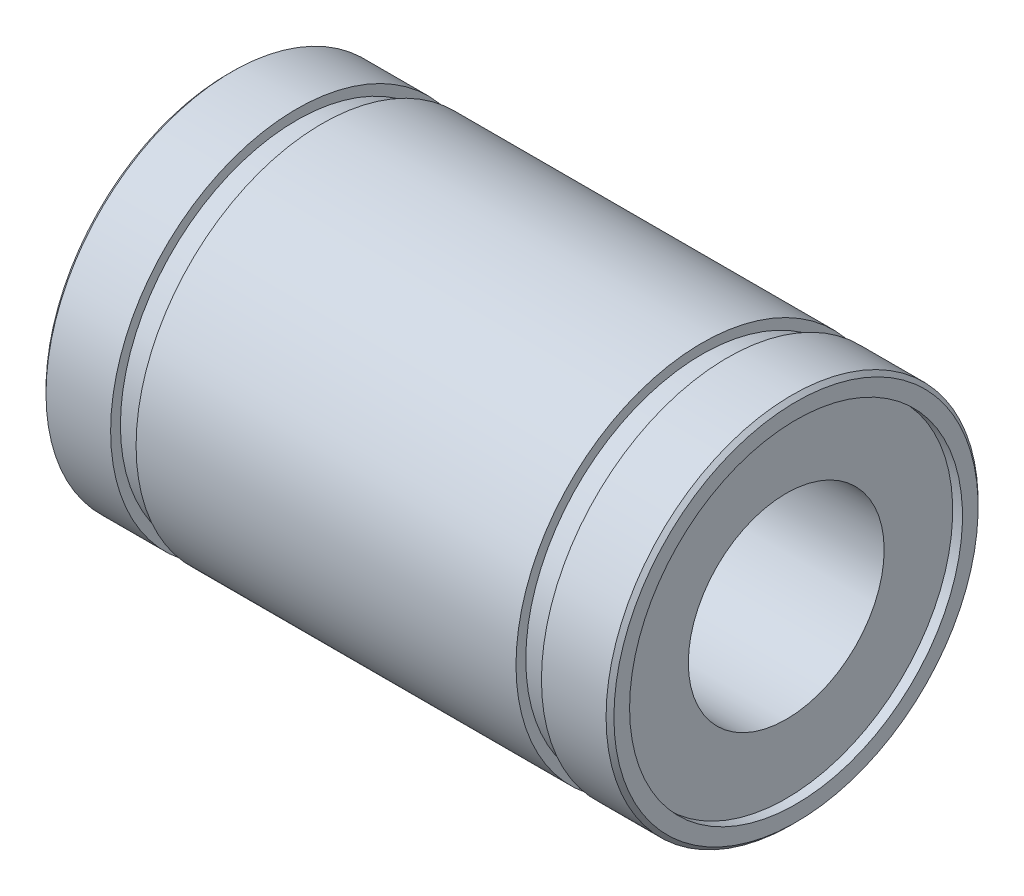
from build123d import *

# Parameters (mm, degrees)
CHAMFER1_SIZE = 0.2


with BuildPart() as part:
    # Sketch1 → Revolve1 (revolve)
    with BuildSketch(Plane.XY, mode=Mode.PRIVATE) as revolve1_sk:
        Polygon((0.5, 5), (0.5, 8.5), (0, 8.5), (0, 9.5), (3.5, 9.5), (3.5, 9), (4.8, 9), (4.8, 9.5), (24.2, 9.5), (24.2, 9), (25.5, 9), (25.5, 9.5), (29, 9.5), (29, 8.5), (28.5, 8.5), (28.5, 5), align=None)
    revolve(revolve1_sk.sketch.rotate(Axis((0, 0, 0), (1, 0, 0)), 90), axis=Axis((0, 0, 0), (1, 0, 0)))

    # Chamfer1
    chamfer1_edges = [part.edges().sort_by_distance(p)[0] for p in [
        (29, 0, -9.5),
        (0, 0, -9.5),
    ]]
    chamfer(chamfer1_edges, length=CHAMFER1_SIZE)


solid = part.part
